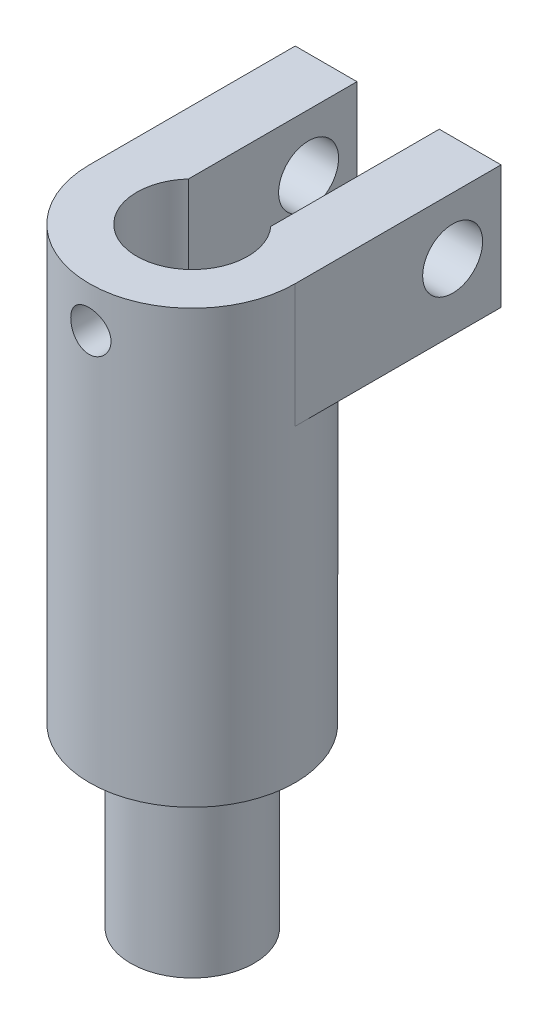
from build123d import *

# Parameters (mm, degrees)
SKETCH1_R                   = 6.35
SKETCH1_R_2                 = 3.429
BOSS_EXTRUDE1_DEPTH         = 19.05
SKETCH2_R                   = 3.81
BOSS_EXTRUDE2_DEPTH         = 10.922
SKETCH3_R                   = 3.429
BOSS_EXTRUDE3_DEPTH         = 7.62
M3_CLEARANCE_HOLE1_D        = 3.7
M3_CLEARANCE_HOLE1_DEPTH    = 25.4
M3_CLEARANCE_HOLE1_TIP      = 1.111592145
CUT_EXTRUDE1_START          = -8.89
CUT_EXTRUDE1_DEPTH          = 8.89
TAP_DRILL_FOR_M3X0_5_TAP1_D = 2.5


with BuildPart() as part:
    # Sketch1 → Boss-Extrude1 (new body)
    with BuildSketch(Plane(origin=(0, 0, 0), x_dir=(1, 0, 0), z_dir=(0, 1, 0))):
        with Locations(Location((0, 0, 0), (0, 0, 90))):
            Circle(SKETCH1_R)
        with Locations(Location((0, 0, 0), (0, 0, 90))):
            Circle(SKETCH1_R_2, mode=Mode.SUBTRACT)
    extrude(amount=BOSS_EXTRUDE1_DEPTH)

    # Sketch2 → Boss-Extrude2 (add)
    with BuildSketch(Plane.XZ):
        with Locations(Location((0, 0, 0), (0, 0, 90))):
            Circle(SKETCH2_R)
    extrude(amount=BOSS_EXTRUDE2_DEPTH)

    # Sketch3 → Boss-Extrude3 (add)
    with BuildSketch(Plane(origin=(0, 19.05, 0), x_dir=(1, 0, 0), z_dir=(0, 1, 0))):
        with BuildLine():
            Line((2.54, 12.7), (2.54, 5.819871133))
            ThreePointArc((2.54, 5.819871133), (0, 6.35), (-2.54, 5.819871133))
            Line((-2.54, 5.819871133), (-2.54, 12.7))
            Line((-2.54, 12.7), (-6.35, 12.7))
            Line((-6.35, 12.7), (-6.35, 0))
            ThreePointArc((-6.35, 0), (0, -6.35), (6.35, 0))
            Line((6.35, 0), (6.35, 12.7))
            Line((6.35, 12.7), (2.54, 12.7))
        make_face()
        with Locations(Location((0, 0, 0), (0, 0, 90))):
            Circle(SKETCH3_R, mode=Mode.SUBTRACT)
    extrude(amount=BOSS_EXTRUDE3_DEPTH)

    # M3 Clearance Hole1
    with Locations(Plane.ZY.offset(6.35)):
        with Locations((-9.714139502, 23.151538797)):
            Hole(M3_CLEARANCE_HOLE1_D / 2, depth=M3_CLEARANCE_HOLE1_DEPTH)
            with Locations((0, 0, -(M3_CLEARANCE_HOLE1_DEPTH + M3_CLEARANCE_HOLE1_TIP / 2))):  # 118° drill point
                Cone(0, M3_CLEARANCE_HOLE1_D / 2, M3_CLEARANCE_HOLE1_TIP, mode=Mode.SUBTRACT)

    # Sketch7 → Cut-Extrude1 (cut)
    with BuildSketch(Plane(origin=(0, 26.67, 0), x_dir=(1, 0, 0), z_dir=(0, 1, 0)).offset(CUT_EXTRUDE1_START)):
        with BuildLine():
            Line((2.54, 2.303571358), (2.54, 5.819871133))
            ThreePointArc((2.54, 5.819871133), (0, 6.35), (-2.54, 5.819871133))
            Line((-2.54, 5.819871133), (-2.54, 2.303571358))
            ThreePointArc((-2.54, 2.303571358), (0, 3.429), (2.54, 2.303571358))
        make_face()
    extrude(amount=CUT_EXTRUDE1_DEPTH, mode=Mode.SUBTRACT)

    # Tap Drill for M3x0.5 Tap1 (through all)
    with Locations(Plane(origin=(-0.033798391, 24.130572857, 6.349910052), x_dir=(0.999985834964, 0, 0.005322581268), z_dir=(-0.005322581268, 0, 0.999985834964))):
        with Locations((0, 0)):
            Hole(TAP_DRILL_FOR_M3X0_5_TAP1_D / 2)


solid = part.part
